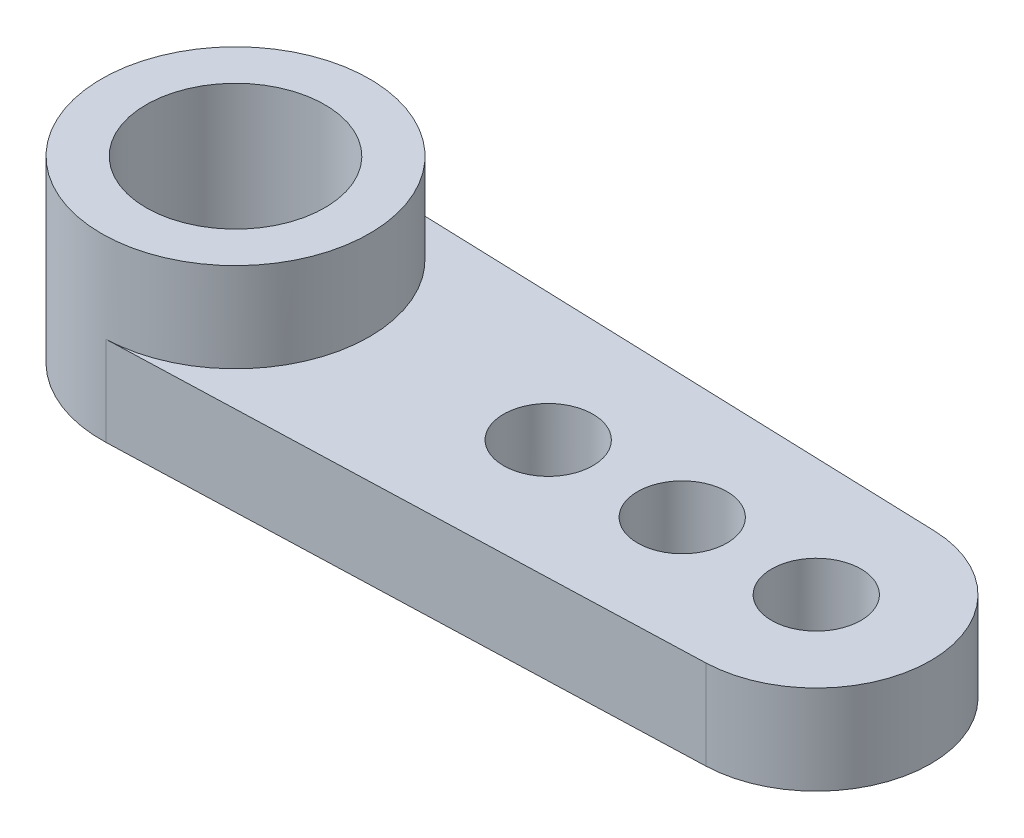
from build123d import *
from build123d.topology import SkipClean

# Parameters (mm, degrees)
EXTRUSION1_DEPTH = 2
EXTRUSION2_REACH = 46.533
ESQUISSE2_R      = 1
ESQUISSE3_R      = 3
ESQUISSE3_R_2    = 2
EXTRUSION3_DEPTH = 2
EXTRUSION4_START = -1
ESQUISSE4_R      = 2
EXTRUSION4_DEPTH = 1


with BuildPart() as part:
    # Esquisse1 → Extrusion1 (new body)
    with BuildSketch(Plane(origin=(0, 0, 0), x_dir=(1, 0, 0), z_dir=(0, 1, 0))):
        with BuildLine():
            Line((-41.28500686, 2.999999015), (-28.299900327, 2.560234019))
            ThreePointArc((-28.299900327, 2.560234019), (-25.826566394, 0.001717984), (-28.299900327, -2.55679805))
            Line((-28.299900327, -2.55679805), (-41.28500686, -2.996563046))
            ThreePointArc((-41.28500686, -2.996563046), (-44.386549273, 0.001717984), (-41.28500686, 2.999999015))
        make_face()
    extrude(amount=EXTRUSION1_DEPTH)

    # Esquisse2 → Extrusion2 (cut, up to next)
    with BuildSketch(Plane(origin=(0, 2, 0), x_dir=(-1, 0, 0), z_dir=(0, 1, 0)), mode=Mode.PRIVATE) as extrusion2_sk1:
        with Locations(Location((34.386549273, -0.001717984, 0), (0, 0, 90))):
            Circle(ESQUISSE2_R)
    extrusion2_tool1 = extrude(extrusion2_sk1.sketch, amount=-EXTRUSION2_REACH, mode=Mode.PRIVATE) & part.part
    # Esquisse2 → Extrusion2 (cut, up to next)
    with BuildSketch(Plane(origin=(0, 2, 0), x_dir=(-1, 0, 0), z_dir=(0, 1, 0)), mode=Mode.PRIVATE) as extrusion2_sk2:
        with Locations(Location((31.386549273, -0.001717984, 0), (0, 0, 90))):
            Circle(ESQUISSE2_R)
    extrusion2_tool2 = extrude(extrusion2_sk2.sketch, amount=-EXTRUSION2_REACH, mode=Mode.PRIVATE) & part.part
    # Esquisse2 → Extrusion2 (cut, up to next)
    with BuildSketch(Plane(origin=(0, 2, 0), x_dir=(-1, 0, 0), z_dir=(0, 1, 0)), mode=Mode.PRIVATE) as extrusion2_sk3:
        with Locations(Location((28.386549273, -0.001717984, 0), (0, 0, 90))):
            Circle(ESQUISSE2_R)
    extrusion2_tool3 = extrude(extrusion2_sk3.sketch, amount=-EXTRUSION2_REACH, mode=Mode.PRIVATE) & part.part
    add(extrusion2_tool1.solids().sort_by_distance((-34.386549, 2, -0.001718))[0], mode=Mode.SUBTRACT)
    add(extrusion2_tool2.solids().sort_by_distance((-31.386549, 2, -0.001718))[0], mode=Mode.SUBTRACT)
    add(extrusion2_tool3.solids().sort_by_distance((-28.386549, 2, -0.001718))[0], mode=Mode.SUBTRACT)

    # Esquisse3 → Extrusion3 (add)
    with SkipClean():  # the faces are left unmerged after this step: merging them gives an invalid solid
        with BuildSketch(Plane(origin=(0, 2, 0), x_dir=(1, 0, 0), z_dir=(0, 1, 0))):
            with Locations(Location((-41.386549273, 0.001717984, 0), (0, 0, 88.060312285))):
                Circle(ESQUISSE3_R)
            with Locations(Location((-41.386549273, 0.001717984, 0), (0, 0, 270))):
                Circle(ESQUISSE3_R_2, mode=Mode.SUBTRACT)
        extrude(amount=EXTRUSION3_DEPTH)

    # Esquisse4 → Extrusion4 (cut)
    with SkipClean():  # the faces are left unmerged after this step: merging them gives an invalid solid
        with BuildSketch(Plane(origin=(0, 2, 0), x_dir=(1, 0, 0), z_dir=(0, 1, 0)).offset(EXTRUSION4_START)):
            with Locations(Location((-41.386549273, 0.001717984, 0), (0, 0, 270))):
                Circle(ESQUISSE4_R)
        extrude(amount=EXTRUSION4_DEPTH, mode=Mode.SUBTRACT)


solid = part.part
